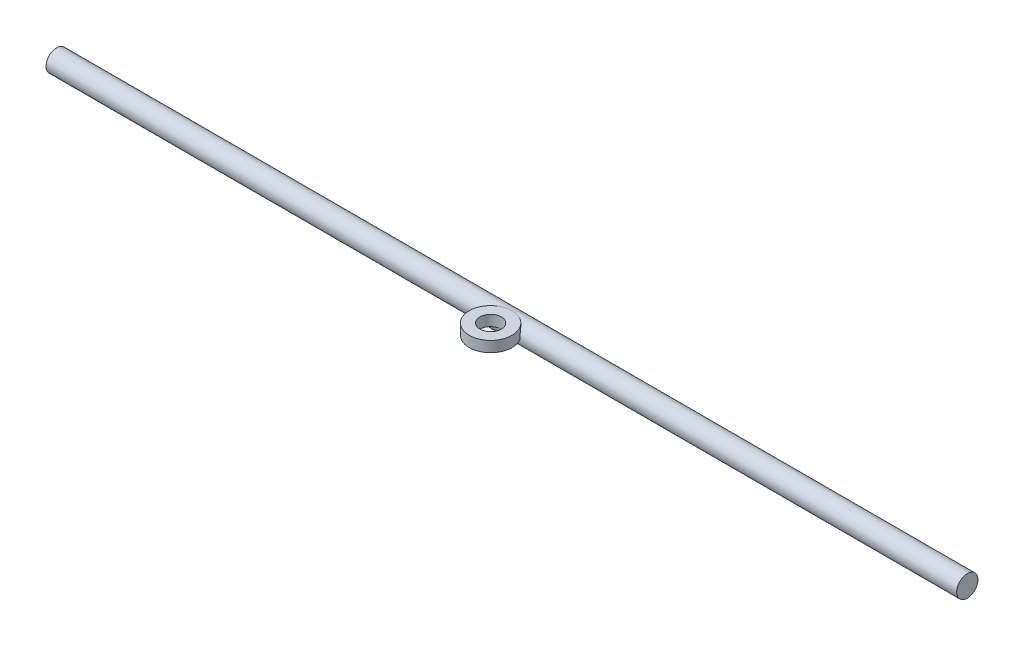
from build123d import *

# Parameters (mm, degrees)
BALAYAGE1_PROFILE_R = 5
ESQUISSE2_R         = 10
ESQUISSE2_R_2       = 5
BOSS_EXTRU_1_DEPTH  = 5


with BuildPart() as part:
    # Balayage1: sweep along a path in Esquisse1
    with BuildLine(Plane.XY) as balayage1_path:
        Line((-213.333333333, 0), (213.333333333, 0))
    # Balayage1 profile (on start of the path) → Balayage1 (sweep)
    with BuildSketch(Plane(origin=(-213.333333333, 0, 0), x_dir=(0, 0, 1), z_dir=(1, 0, 0))):
        Circle(BALAYAGE1_PROFILE_R)
    sweep(path=balayage1_path.line)

    # Esquisse2 → Boss.-Extru.1 (add)
    with BuildSketch(Plane(origin=(0, 0, 0), x_dir=(1, 0, 0), z_dir=(0, 1, 0))):
        with Locations((0, -10)):
            Circle(ESQUISSE2_R)
        with Locations(Location((0, -10, 0), (0, 0, 90))):
            Circle(ESQUISSE2_R_2, mode=Mode.SUBTRACT)
    extrude(amount=BOSS_EXTRU_1_DEPTH)


solid = part.part
